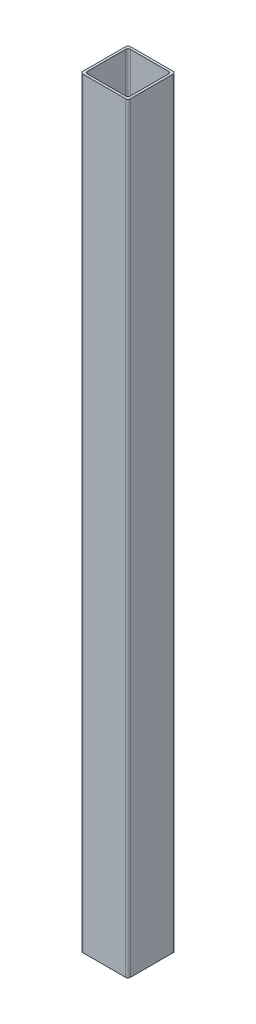
from build123d import *

# Parameters (mm, degrees)
EXTRUDE_1_DEPTH = 640


with BuildPart() as part:
    # Эскиз1 → Бобышка-Вытянуть1 (new body)
    with BuildSketch(Plane(origin=(0, 0, 0), x_dir=(1, 0, 0), z_dir=(0, 1, 0))):
        with BuildLine():
            Line((18, -20), (-18, -20))
            ThreePointArc((-18, -20), (-19.414213562, -19.414213562), (-20, -18))
            Line((-20, -18), (-20, 18))
            ThreePointArc((-20, 18), (-19.414213562, 19.414213562), (-18, 20))
            Line((-18, 20), (18, 20))
            ThreePointArc((18, 20), (19.414213562, 19.414213562), (20, 18))
            Line((20, 18), (20, -18))
            ThreePointArc((20, -18), (19.414213562, -19.414213562), (18, -20))
        make_face()
        with BuildLine():
            Line((16, -18), (-16, -18))
            ThreePointArc((-16, -18), (-17.414213562, -17.414213562), (-18, -16))
            Line((-18, -16), (-18, 16))
            ThreePointArc((-18, 16), (-17.414213562, 17.414213562), (-16, 18))
            Line((-16, 18), (16, 18))
            ThreePointArc((16, 18), (17.414213562, 17.414213562), (18, 16))
            Line((18, 16), (18, -16))
            ThreePointArc((18, -16), (17.414213562, -17.414213562), (16, -18))
        make_face(mode=Mode.SUBTRACT)
    extrude(amount=EXTRUDE_1_DEPTH)


solid = part.part
